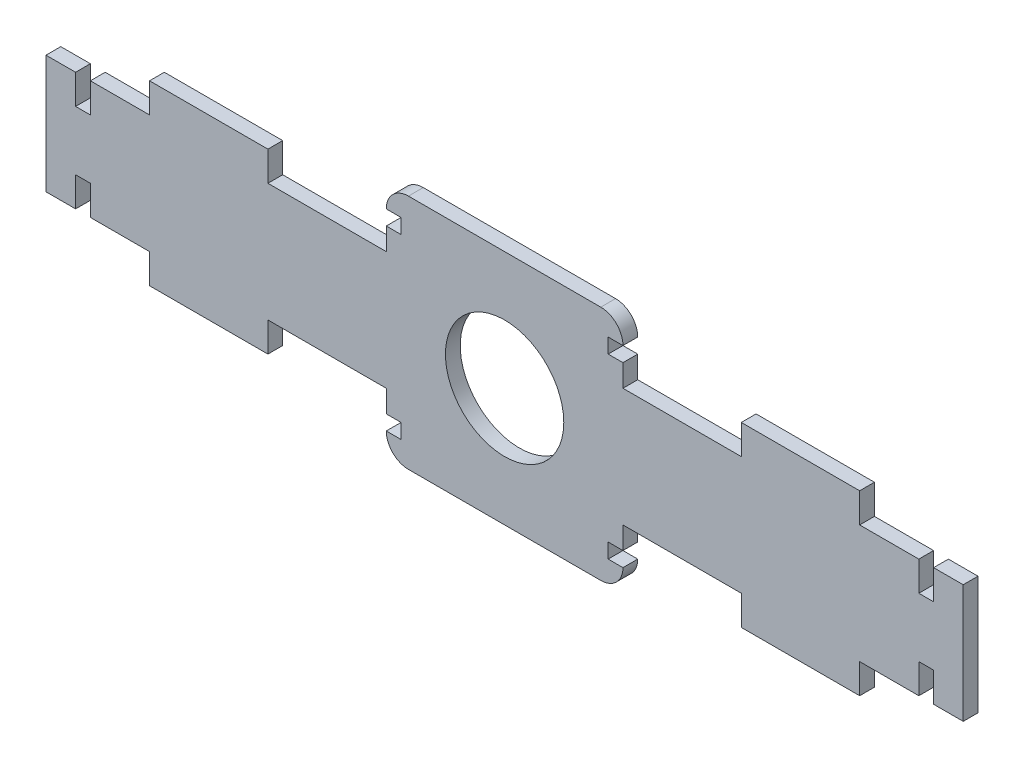
from build123d import *

# Parameters (mm, degrees)
BOSS_EXTRUDE1_DEPTH = 3.175
CUT_EXTRUDE3_DEPTH  = 3.175


with BuildPart() as part:
    # Sketch2 → Boss-Extrude1 (new body)
    with BuildSketch(Plane.XY):
        with BuildLine():
            Line((0, 12.7), (0, 25.4))
            Line((0, 25.4), (-98.425, 25.4))
            Line((-98.425, 25.4), (-98.425, -25.4))
            Line((-98.425, -25.4), (0, -25.4))
            Line((0, -25.4), (0, -12.7))
            ThreePointArc((0, -12.7), (-12.7, 0), (0, 12.7))
        make_face()
        with BuildLine():
            Line((98.425, 25.4), (0, 25.4))
            Line((0, 25.4), (0, 12.7))
            ThreePointArc((0, 12.7), (8.980256121, 8.980256121), (12.7, 0))
            ThreePointArc((12.7, 0), (8.980256121, -8.980256121), (0, -12.7))
            Line((0, -12.7), (0, -25.4))
            Line((0, -25.4), (98.425, -25.4))
            Line((98.425, -25.4), (98.425, 25.4))
        make_face()
    extrude(amount=BOSS_EXTRUDE1_DEPTH)

    # Sketch6 → Cut-Extrude3 (cut)
    with BuildSketch(Plane.XY):
        with BuildLine():
            Line((-22.225, 20.6375), (-25.4, 20.6375))
            ThreePointArc((-25.4, 20.6375), (-24.005096045, 24.005096045), (-20.6375, 25.4))
            Line((-20.6375, 25.4), (-25.4, 25.4))
            Line((-25.4, 25.4), (-98.425, 25.4))
            Line((-98.425, 25.4), (-98.425, 12.7))
            Line((-98.425, 12.7), (-92.075, 12.7))
            Line((-92.075, 12.7), (-92.075, 6.35))
            Line((-92.075, 6.35), (-88.9, 6.35))
            Line((-88.9, 6.35), (-88.9, 12.7))
            Line((-88.9, 12.7), (-76.2, 12.7))
            Line((-76.2, 12.7), (-76.2, 19.05))
            Line((-76.2, 19.05), (-50.8, 19.05))
            Line((-50.8, 19.05), (-50.8, 12.7))
            Line((-50.8, 12.7), (-25.4, 12.7))
            Line((-25.4, 12.7), (-25.4, 17.4625))
            Line((-25.4, 17.4625), (-22.225, 17.4625))
            Line((-22.225, 17.4625), (-22.225, 20.6375))
        make_face()
        with BuildLine():
            ThreePointArc((25.4, 20.6375), (24.005096045, 24.005096045), (20.6375, 25.4))
            Line((20.6375, 25.4), (25.4, 25.4))
            Line((25.4, 25.4), (98.425, 25.4))
            Line((98.425, 25.4), (98.425, 12.7))
            Line((98.425, 12.7), (92.075, 12.7))
            Line((92.075, 12.7), (92.075, 6.35))
            Line((92.075, 6.35), (88.9, 6.35))
            Line((88.9, 6.35), (88.9, 12.7))
            Line((88.9, 12.7), (76.2, 12.7))
            Line((76.2, 12.7), (76.2, 19.05))
            Line((76.2, 19.05), (50.8, 19.05))
            Line((50.8, 19.05), (50.8, 12.7))
            Line((50.8, 12.7), (25.4, 12.7))
            Line((25.4, 12.7), (25.4, 17.4625))
            Line((25.4, 17.4625), (22.225, 17.4625))
            Line((22.225, 17.4625), (22.225, 20.6375))
            Line((22.225, 20.6375), (25.4, 20.6375))
        make_face()
        with BuildLine():
            ThreePointArc((-25.4, -20.6375), (-24.005096045, -24.005096045), (-20.6375, -25.4))
            Line((-20.6375, -25.4), (-25.4, -25.4))
            Line((-25.4, -25.4), (-98.425, -25.4))
            Line((-98.425, -25.4), (-98.425, -12.7))
            Line((-98.425, -12.7), (-92.075, -12.7))
            Line((-92.075, -12.7), (-92.075, -6.35))
            Line((-92.075, -6.35), (-88.9, -6.35))
            Line((-88.9, -6.35), (-88.9, -12.7))
            Line((-88.9, -12.7), (-76.2, -12.7))
            Line((-76.2, -12.7), (-76.2, -19.05))
            Line((-76.2, -19.05), (-50.8, -19.05))
            Line((-50.8, -19.05), (-50.8, -12.7))
            Line((-50.8, -12.7), (-25.4, -12.7))
            Line((-25.4, -12.7), (-25.4, -17.4625))
            Line((-25.4, -17.4625), (-22.225, -17.4625))
            Line((-22.225, -17.4625), (-22.225, -20.6375))
            Line((-22.225, -20.6375), (-25.4, -20.6375))
        make_face()
        with BuildLine():
            Line((22.225, -20.6375), (25.4, -20.6375))
            ThreePointArc((25.4, -20.6375), (24.005096045, -24.005096045), (20.6375, -25.4))
            Line((20.6375, -25.4), (25.4, -25.4))
            Line((25.4, -25.4), (98.425, -25.4))
            Line((98.425, -25.4), (98.425, -12.7))
            Line((98.425, -12.7), (92.075, -12.7))
            Line((92.075, -12.7), (92.075, -6.35))
            Line((92.075, -6.35), (88.9, -6.35))
            Line((88.9, -6.35), (88.9, -12.7))
            Line((88.9, -12.7), (76.2, -12.7))
            Line((76.2, -12.7), (76.2, -19.05))
            Line((76.2, -19.05), (50.8, -19.05))
            Line((50.8, -19.05), (50.8, -12.7))
            Line((50.8, -12.7), (25.4, -12.7))
            Line((25.4, -12.7), (25.4, -17.4625))
            Line((25.4, -17.4625), (22.225, -17.4625))
            Line((22.225, -17.4625), (22.225, -20.6375))
        make_face()
    extrude(amount=CUT_EXTRUDE3_DEPTH, mode=Mode.SUBTRACT)


solid = part.part
